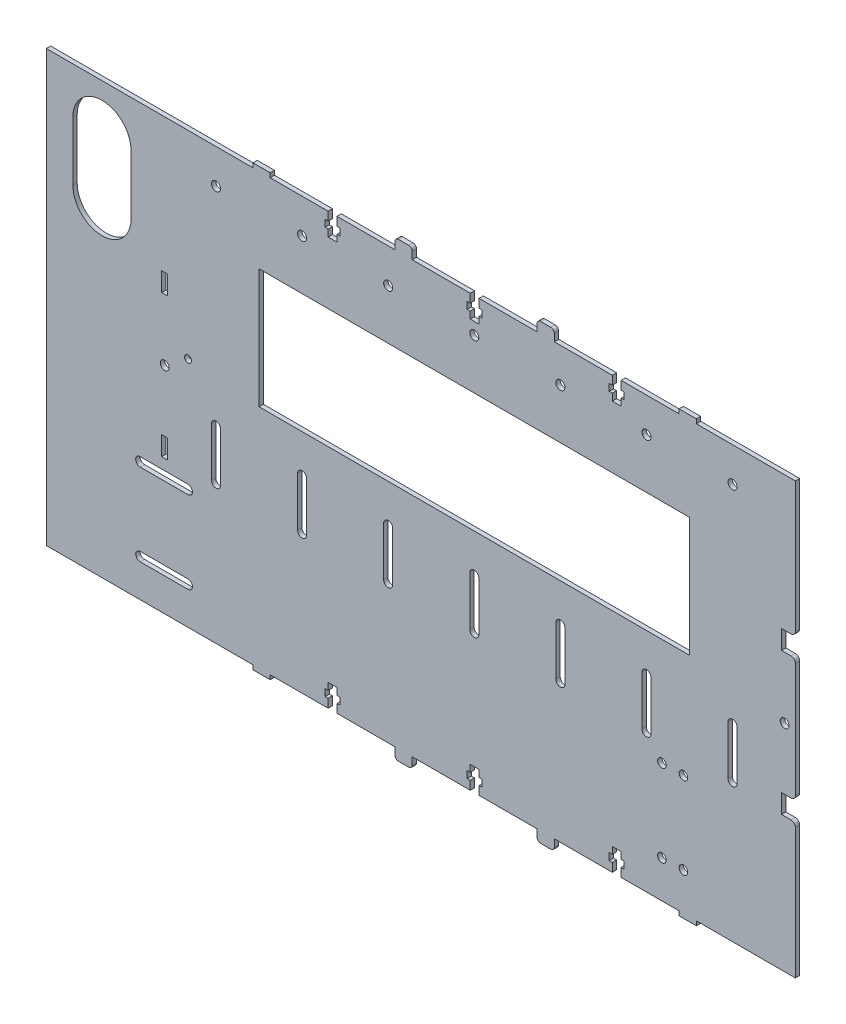
from build123d import *

# Parameters (mm, degrees)
SKETCH_1_R          = 2.05
SKETCH_1_R_2        = 2.1
SKETCH_1_R_3        = 2
SKETCH_1_R_4        = 1.596596984
SKETCH_1_W          = 2.8
SKETCH_1_H          = 8.8
SKETCH_1_W_2        = 200
SKETCH_1_H_2        = 55.5
EXTRUDE_1_DEPTH     = 2
SKETCH_4_W          = 20.705410864
SKETCH_4_H          = 9.065612324
SKETCH_4_W_2        = 41.972556438
SKETCH_4_H_2        = 18.504030257
SKETCH_4_W_3        = 50.856698359
SKETCH_4_H_3        = 15.038626171
SKETCH_4_W_4        = 39.455714808
SKETCH_4_H_4        = 14.320729145
CUT_EXTRUDE_1_DEPTH = 2
FILLET_1_R          = 1.6
SKETCH_5_W          = 7.76953839
SKETCH_5_H          = 8.8
SKETCH_5_W_2        = 11.286956809
CUT_EXTRUDE_2_DEPTH = 2
FILLET_2_R          = 2


with BuildPart() as part:
    # 草图1 → 凸台-拉伸1 (new body)
    with BuildSketch(Plane.XY):
        Polygon((0, 0), (0, -4), (-1.45, -4), (-1.45, -7.2), (0, -7.2), (0, -10.4), (4.1, -10.4), (4.1, -7.2), (5.55, -7.2), (5.55, -4), (4.1, -4), (4.1, 0), (31.05, 0), (31.05, 5), (39.05, 5), (39.05, 0), (66, 0), (66, -4), (64.55, -4), (64.55, -7.2), (66, -7.2), (66, -10.4), (70.1, -10.4), (70.1, -7.2), (71.55, -7.2), (71.55, -4), (70.1, -4), (70.1, 0), (97.05, 0), (97.05, 5), (105.05, 5), (105.05, 0), (132, 0), (144.05, 0), (146.05, 0), (151.05, 0), (151.05, -200), (146.05, -200), (144.05, -200), (132, -200), (105.05, -200), (105.05, -205), (97.05, -205), (97.05, -200), (70.1, -200), (70.1, -196), (71.55, -196), (71.55, -192.8), (70.1, -192.8), (70.1, -189.6), (66, -189.6), (66, -192.8), (64.55, -192.8), (64.55, -196), (66, -196), (66, -200), (39.05, -200), (39.05, -205), (31.05, -205), (31.05, -200), (4.1, -200), (4.1, -196), (5.55, -196), (5.55, -192.8), (4.1, -192.8), (4.1, -189.6), (0, -189.6), (0, -192.8), (-1.45, -192.8), (-1.45, -196), (0, -196), (0, -200), (-26.95, -200), (-26.95, -205), (-34.95, -205), (-34.95, -200), (-61.9, -200), (-61.9, -196), (-60.45, -196), (-60.45, -192.8), (-61.9, -192.8), (-61.9, -189.6), (-66, -189.6), (-66, -192.8), (-67.45, -192.8), (-67.45, -196), (-66, -196), (-66, -200), (-92.95, -200), (-92.95, -205), (-100.95, -205), (-100.95, -200), (-127.9, -200), (-139.95, -200), (-141.95, -200), (-146.95, -200), (-196.95, -200), (-196.95, 0), (-146.95, 0), (-141.95, 0), (-139.95, 0), (-127.9, 0), (-100.95, 0), (-100.95, 5), (-92.95, 5), (-92.95, 0), (-66, 0), (-66, -4), (-67.45, -4), (-67.45, -7.2), (-66, -7.2), (-66, -10.4), (-61.9, -10.4), (-61.9, -7.2), (-60.45, -7.2), (-60.45, -4), (-61.9, -4), (-61.9, 0), (-34.95, 0), (-34.95, 5), (-26.95, 5), (-26.95, 0), align=None)
        with Locations((-141.95, -100)):
            Circle(SKETCH_1_R, mode=Mode.SUBTRACT)
        with Locations((146.05, -100)):
            Circle(SKETCH_1_R, mode=Mode.SUBTRACT)
        with Locations((-118.120950129, -16)):
            Circle(SKETCH_1_R_2, mode=Mode.SUBTRACT)
        with Locations((-78.120950129, -16)):
            Circle(SKETCH_1_R_2, mode=Mode.SUBTRACT)
        with Locations((-38.120950129, -16)):
            Circle(SKETCH_1_R_2, mode=Mode.SUBTRACT)
        with Locations((1.879049871, -16)):
            Circle(SKETCH_1_R_2, mode=Mode.SUBTRACT)
        with Locations((41.879049871, -16)):
            Circle(SKETCH_1_R_2, mode=Mode.SUBTRACT)
        with Locations((81.879049871, -16)):
            Circle(SKETCH_1_R_2, mode=Mode.SUBTRACT)
        with Locations((99.05, -182.517403611)):
            Circle(SKETCH_1_R_3, mode=Mode.SUBTRACT)
        with Locations((99.05, -144.517403611)):
            Circle(SKETCH_1_R_3, mode=Mode.SUBTRACT)
        with Locations((89.05, -144.517403611)):
            Circle(SKETCH_1_R_3, mode=Mode.SUBTRACT)
        with Locations((89.050600627, -182.627003683)):
            Circle(SKETCH_1_R_3, mode=Mode.SUBTRACT)
        with Locations((121.879049871, -16)):
            Circle(SKETCH_1_R_2, mode=Mode.SUBTRACT)
        with Locations((-131.123167438, -92.012309478)):
            Circle(SKETCH_1_R_4, mode=Mode.SUBTRACT)
        with Locations((-141.95, -67)):
            Rectangle(SKETCH_1_W, SKETCH_1_H, mode=Mode.SUBTRACT)
        with Locations((-141.95, -133)):
            Rectangle(SKETCH_1_W, SKETCH_1_H, mode=Mode.SUBTRACT)
        with Locations((146.05, -133)):
            Rectangle(SKETCH_1_W, SKETCH_1_H, mode=Mode.SUBTRACT)
        with Locations((146.05, -67)):
            Rectangle(SKETCH_1_W, SKETCH_1_H, mode=Mode.SUBTRACT)
        with BuildLine():
            Line((-80.220950129, -135.421434051), (-80.220950129, -112.578565949))
            ThreePointArc((-80.220950129, -112.578565949), (-78.120950129, -110.478565949), (-76.020950129, -112.578565949))
            Line((-76.020950129, -112.578565949), (-76.020950129, -135.421434051))
            ThreePointArc((-76.020950129, -135.421434051), (-78.120950129, -137.521434051), (-80.220950129, -135.421434051))
        make_face(mode=Mode.SUBTRACT)
        with Locations((1.879049871, -66.985697847)):
            Rectangle(SKETCH_1_W_2, SKETCH_1_H_2, mode=Mode.SUBTRACT)
        with BuildLine():
            Line((-120.220950129, -135.421434051), (-120.220950129, -112.578565949))
            ThreePointArc((-120.220950129, -112.578565949), (-118.120950129, -110.478565949), (-116.020950129, -112.578565949))
            Line((-116.020950129, -112.578565949), (-116.020950129, -135.421434051))
            ThreePointArc((-116.020950129, -135.421434051), (-118.120950129, -137.521434051), (-120.220950129, -135.421434051))
        make_face(mode=Mode.SUBTRACT)
        with BuildLine():
            Line((-40.220950129, -135.421434051), (-40.220950129, -112.578565949))
            ThreePointArc((-40.220950129, -112.578565949), (-38.120950129, -110.478565949), (-36.020950129, -112.578565949))
            Line((-36.020950129, -112.578565949), (-36.020950129, -135.421434051))
            ThreePointArc((-36.020950129, -135.421434051), (-38.120950129, -137.521434051), (-40.220950129, -135.421434051))
        make_face(mode=Mode.SUBTRACT)
        with BuildLine():
            Line((-0.220950129, -135.421434051), (-0.220950129, -112.578565949))
            ThreePointArc((-0.220950129, -112.578565949), (1.879049871, -110.478565949), (3.979049871, -112.578565949))
            Line((3.979049871, -112.578565949), (3.979049871, -135.421434051))
            ThreePointArc((3.979049871, -135.421434051), (1.879049871, -137.521434051), (-0.220950129, -135.421434051))
        make_face(mode=Mode.SUBTRACT)
        with BuildLine():
            Line((39.779049871, -135.421434051), (39.779049871, -112.578565949))
            ThreePointArc((39.779049871, -112.578565949), (41.879049871, -110.478565949), (43.979049871, -112.578565949))
            Line((43.979049871, -112.578565949), (43.979049871, -135.421434051))
            ThreePointArc((43.979049871, -135.421434051), (41.879049871, -137.521434051), (39.779049871, -135.421434051))
        make_face(mode=Mode.SUBTRACT)
        with BuildLine():
            Line((79.779049871, -135.421434051), (79.779049871, -112.578565949))
            ThreePointArc((79.779049871, -112.578565949), (81.879049871, -110.478565949), (83.979049871, -112.578565949))
            Line((83.979049871, -112.578565949), (83.979049871, -135.421434051))
            ThreePointArc((83.979049871, -135.421434051), (81.879049871, -137.521434051), (79.779049871, -135.421434051))
        make_face(mode=Mode.SUBTRACT)
        with BuildLine():
            Line((119.779049871, -135.421434051), (119.779049871, -112.578565949))
            ThreePointArc((119.779049871, -112.578565949), (121.879049871, -110.478565949), (123.979049871, -112.578565949))
            Line((123.979049871, -112.578565949), (123.979049871, -135.421434051))
            ThreePointArc((123.979049871, -135.421434051), (121.879049871, -137.521434051), (119.779049871, -135.421434051))
        make_face(mode=Mode.SUBTRACT)
        with BuildLine():
            Line((-153.322396497, -142.417403611), (-131.177603503, -142.417403611))
            ThreePointArc((-131.177603503, -142.417403611), (-129.077603503, -144.517403611), (-131.177603503, -146.617403611))
            Line((-131.177603503, -146.617403611), (-153.322396497, -146.617403611))
            ThreePointArc((-153.322396497, -146.617403611), (-155.422396497, -144.517403611), (-153.322396497, -142.417403611))
        make_face(mode=Mode.SUBTRACT)
        with BuildLine():
            Line((-153.322396497, -180.527003683), (-131.177603503, -180.527003683))
            ThreePointArc((-131.177603503, -180.527003683), (-129.077603503, -182.627003683), (-131.177603503, -184.727003683))
            Line((-131.177603503, -184.727003683), (-153.322396497, -184.727003683))
            ThreePointArc((-153.322396497, -184.727003683), (-155.422396497, -182.627003683), (-153.322396497, -180.527003683))
        make_face(mode=Mode.SUBTRACT)
        with BuildLine():
            Line((-157.592220434, -21.411124162), (-157.592220434, -48.874356868))
            ThreePointArc((-157.592220434, -48.874356868), (-171.105830678, -62.387967111), (-184.619440921, -48.874356868))
            Line((-184.619440921, -48.874356868), (-184.619440921, -21.411124162))
            ThreePointArc((-184.619440921, -21.411124162), (-171.105830678, -7.897513919), (-157.592220434, -21.411124162))
        make_face(mode=Mode.SUBTRACT)
    extrude(amount=EXTRUDE_1_DEPTH)

    # 草图4 → 切除-拉伸1 (cut)
    with BuildSketch(Plane.XY.offset(2)):
        with Locations((100.492114265, 6.532806162)):
            Rectangle(SKETCH_4_W, SKETCH_4_H)
        with Locations((108.073065758, -211.252015129)):
            Rectangle(SKETCH_4_W_2, SKETCH_4_H_2)
        with Locations((-100.387548901, -209.519313086)):
            Rectangle(SKETCH_4_W_3, SKETCH_4_H_3)
        with Locations((-106.088040676, 9.160364573)):
            Rectangle(SKETCH_4_W_4, SKETCH_4_H_4)
    extrude(amount=-CUT_EXTRUDE_1_DEPTH, mode=Mode.SUBTRACT)

    # 圆角1
    fillet_1_edges = [part.edges().sort_by_distance(p)[0] for p in [
        (-34.95, 5, 1),
        (-26.95, 5, 1),
        (31.05, 5, 1),
        (39.05, 5, 1),
        (39.05, -205, 1),
        (31.05, -205, 1),
        (-26.95, -205, 1),
        (-34.95, -205, 1),
    ]]
    fillet(fillet_1_edges, radius=FILLET_1_R)

    # 草图5 → 切除-拉伸2 (cut)
    with BuildSketch(Plane.XY.offset(2)):
        with Locations((151.334769195, -67)):
            Rectangle(SKETCH_5_W, SKETCH_5_H)
        with Locations((153.093478405, -133)):
            Rectangle(SKETCH_5_W_2, SKETCH_5_H)
    extrude(amount=-CUT_EXTRUDE_2_DEPTH, mode=Mode.SUBTRACT)

    # 圆角2
    fillet_2_edges = [part.edges().sort_by_distance(p)[0] for p in [
        (151.05, -62.6, 1),
        (151.05, -71.4, 1),
        (151.05, -128.6, 1),
        (151.05, -137.4, 1),
    ]]
    fillet(fillet_2_edges, radius=FILLET_2_R)


solid = part.part
